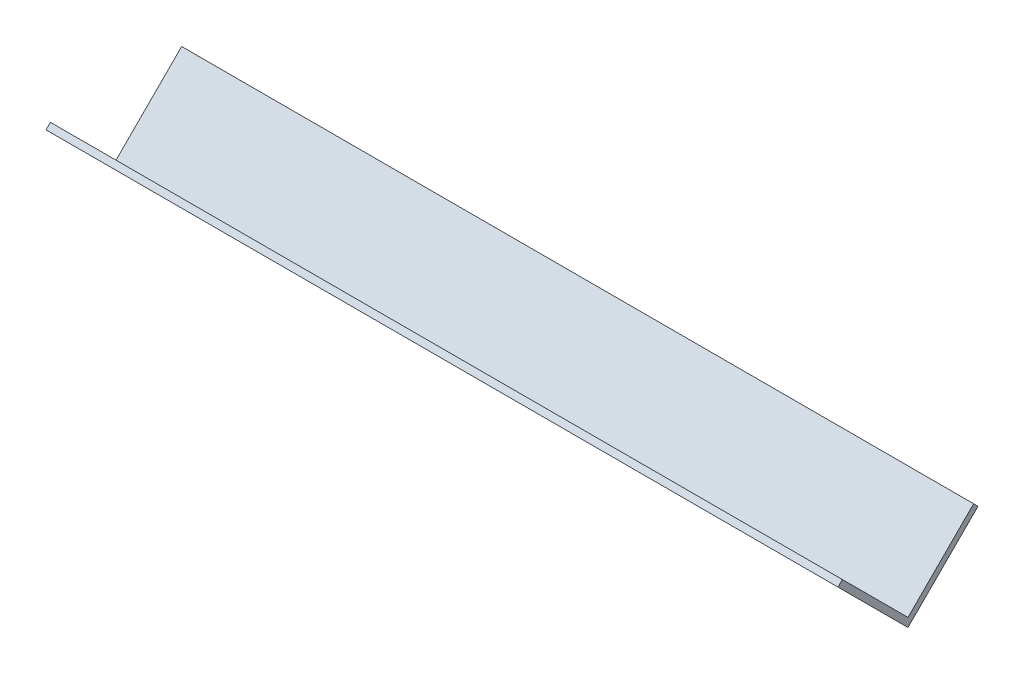
from build123d import *

# Parameters (mm, degrees)
BOSS_EXTRUDE1_DEPTH = 406.4


with BuildPart() as part:
    # Sketch1 → Boss-Extrude1 (new body)
    with BuildSketch(Plane(origin=(0, 0, 0), x_dir=(0, 0, -1), z_dir=(1, 0, 0))):
        Polygon((0, 0), (-35.921024484, 35.921024484), (-33.675960454, 38.166088515), (0, 4.490128061), (33.675960454, 38.166088515), (35.921024484, 35.921024484), align=None)
    extrude(amount=BOSS_EXTRUDE1_DEPTH)


solid = part.part
